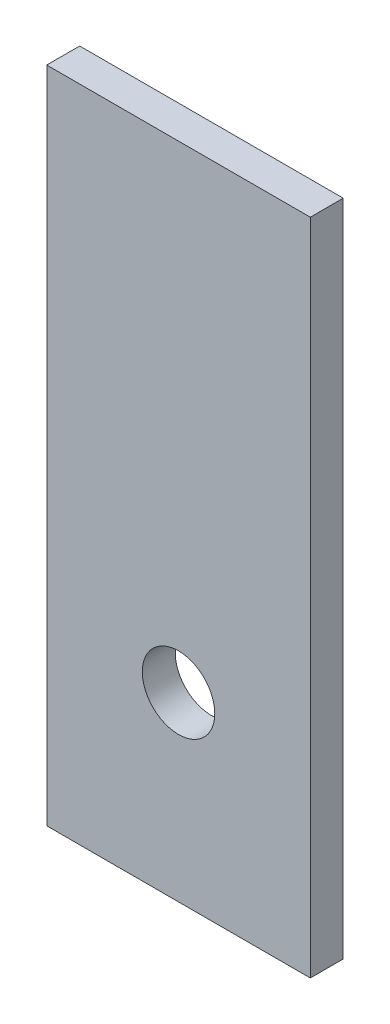
from build123d import *

# Parameters (mm, degrees)
CROQUIS1_W              = 80
CROQUIS1_H              = 200
CROQUIS1_R              = 11
SALIENTE_EXTRUIR1_DEPTH = 10


with BuildPart() as part:
    # Croquis1 → Saliente-Extruir1 (new body)
    with BuildSketch(Plane.XY):
        with Locations((40, 100)):
            Rectangle(CROQUIS1_W, CROQUIS1_H)
        with Locations((40, 55)):
            Circle(CROQUIS1_R, mode=Mode.SUBTRACT)
    extrude(amount=SALIENTE_EXTRUIR1_DEPTH)


solid = part.part
